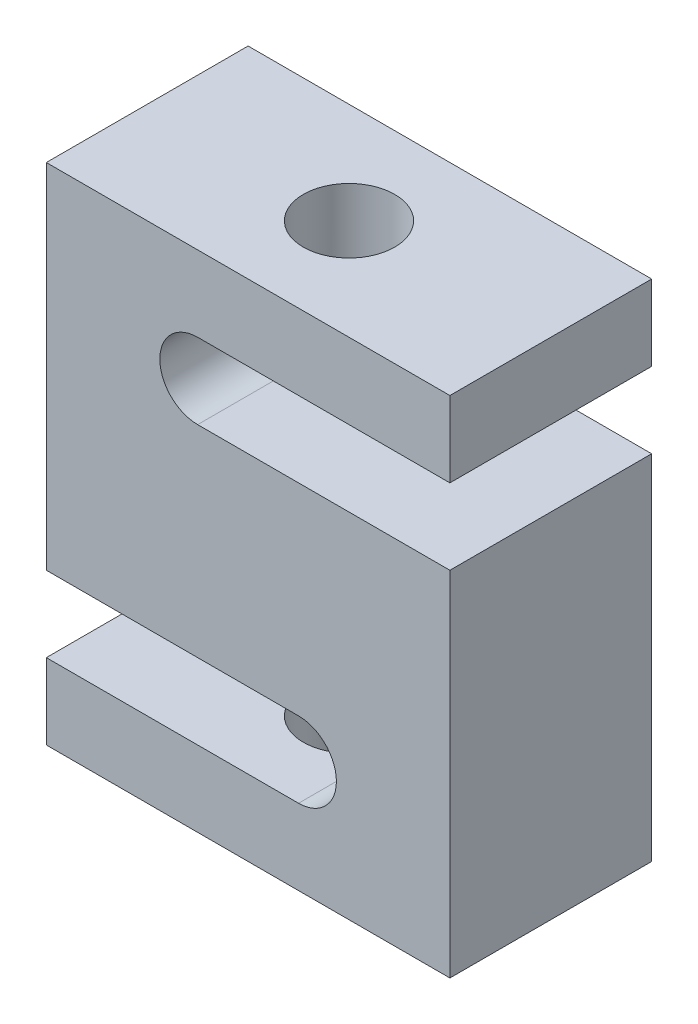
from build123d import *

# Parameters (mm, degrees)
BOSS_EXTRUDE1_DEPTH         = 12.7
F_1_2_20_TAPPED_HOLE1_D     = 11.50874
F_1_2_20_TAPPED_HOLE1_DEPTH = 9.525


with BuildPart() as part:
    # Sketch2 → Boss-Extrude1 (new, symmetric)
    with BuildSketch(Plane.XY):
        with BuildLine():
            Line((0, -31.75), (50.8, -31.75))
            Line((50.8, -31.75), (50.8, 12.7))
            Line((50.8, 12.7), (19.05, 12.7))
            ThreePointArc((19.05, 12.7), (14.2875, 17.4625), (19.05, 22.225))
            Line((19.05, 22.225), (50.8, 22.225))
            Line((50.8, 22.225), (50.8, 31.75))
            Line((50.8, 31.75), (0, 31.75))
            Line((0, 31.75), (0, -12.7))
            Line((0, -12.7), (31.75, -12.7))
            ThreePointArc((31.75, -12.7), (36.5125, -17.4625), (31.75, -22.225))
            Line((31.75, -22.225), (0, -22.225))
            Line((0, -22.225), (0, -31.75))
        make_face()
    extrude(amount=BOSS_EXTRUDE1_DEPTH, both=True)

    # 1/2-20 Tapped Hole1
    with Locations(Plane(origin=(0, 31.75, 0), x_dir=(1, 0, 0), z_dir=(0, 1, 0))):
        with Locations((25.4, 0)):
            f_1_2_20_tapped_hole1 = Hole(F_1_2_20_TAPPED_HOLE1_D / 2, depth=F_1_2_20_TAPPED_HOLE1_DEPTH)

    # Mirror1: 1/2-20 Tapped Hole1 across plane
    add(f_1_2_20_tapped_hole1.mirror(Plane.ZX), mode=Mode.SUBTRACT)


solid = part.part
